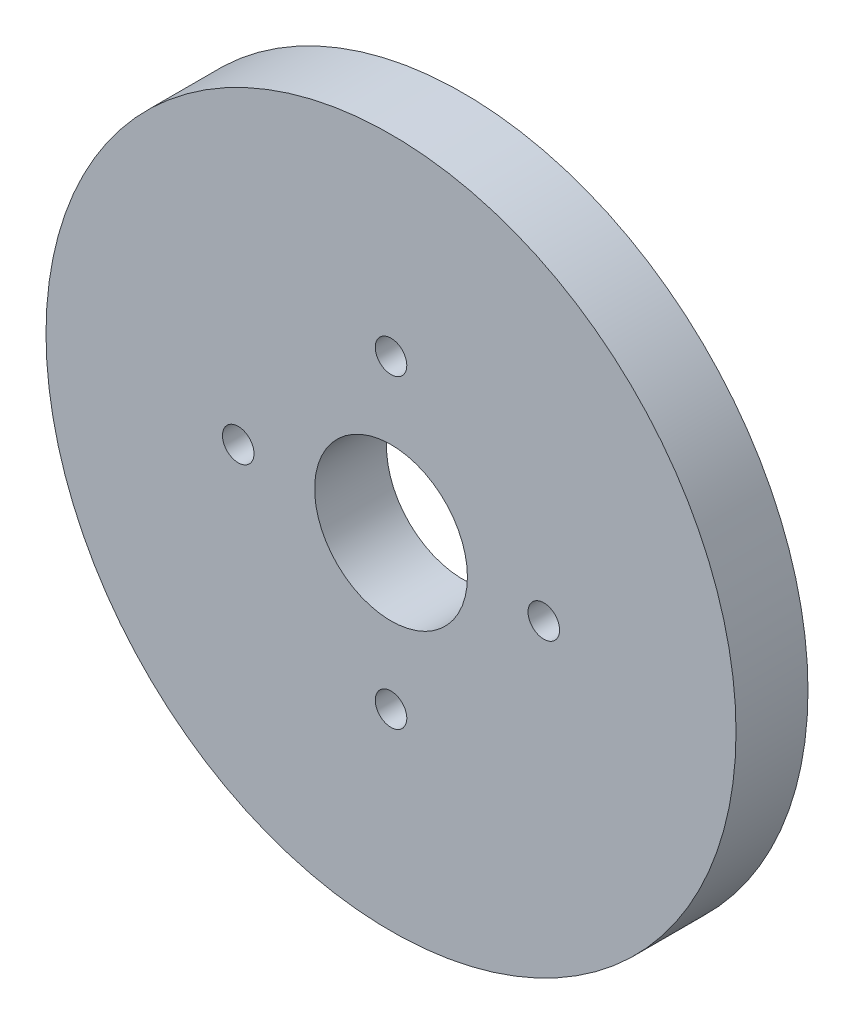
from build123d import *

# Parameters (mm, degrees)
SKETCH1_R           = 17.5
SKETCH1_R_2         = 3.875
SKETCH1_R_3         = 0.8
BOSS_EXTRUDE1_DEPTH = 1.825


with BuildPart() as part:
    # Sketch1 → Boss-Extrude1 (new, symmetric)
    with BuildSketch(Plane.XY):
        Circle(SKETCH1_R)
        Circle(SKETCH1_R_2, mode=Mode.SUBTRACT)
        with Locations((7.75, 0)):
            Circle(SKETCH1_R_3, mode=Mode.SUBTRACT)
        with Locations((0, 7.75)):
            Circle(SKETCH1_R_3, mode=Mode.SUBTRACT)
        with Locations(Location((-7.75, 0, 0), (0, 0, 180))):
            Circle(SKETCH1_R_3, mode=Mode.SUBTRACT)
        with Locations(Location((0, -7.75, 0), (0, 0, 180))):
            Circle(SKETCH1_R_3, mode=Mode.SUBTRACT)
    extrude(amount=BOSS_EXTRUDE1_DEPTH, both=True)


solid = part.part
